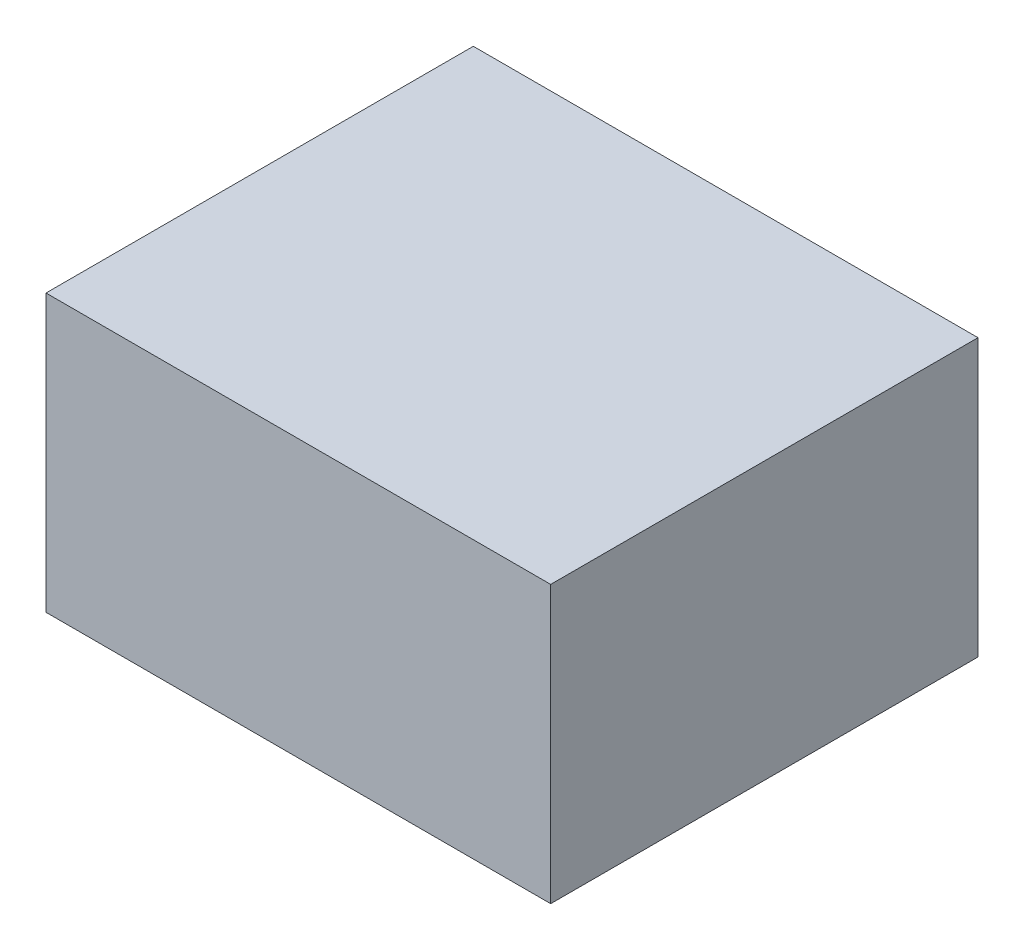
from build123d import *

# Parameters (mm, degrees)
CURVEBOSS_DEPTH      = 7.127
CURVEBOSS_DEPTH_BACK = 19.729
CURVESKETCH_W        = 31.719
CURVESKETCH_H        = 17.381


with BuildPart() as part:
    # CurveSketch → CurveBoss (new, two sides: drawn at the far end of the back side and taken through both)
    with BuildSketch(Plane.XY.offset(-CURVEBOSS_DEPTH_BACK)):
        with Locations((-4.193, 6.827)):
            Rectangle(CURVESKETCH_W, CURVESKETCH_H)
    extrude(amount=CURVEBOSS_DEPTH + CURVEBOSS_DEPTH_BACK)


solid = part.part
